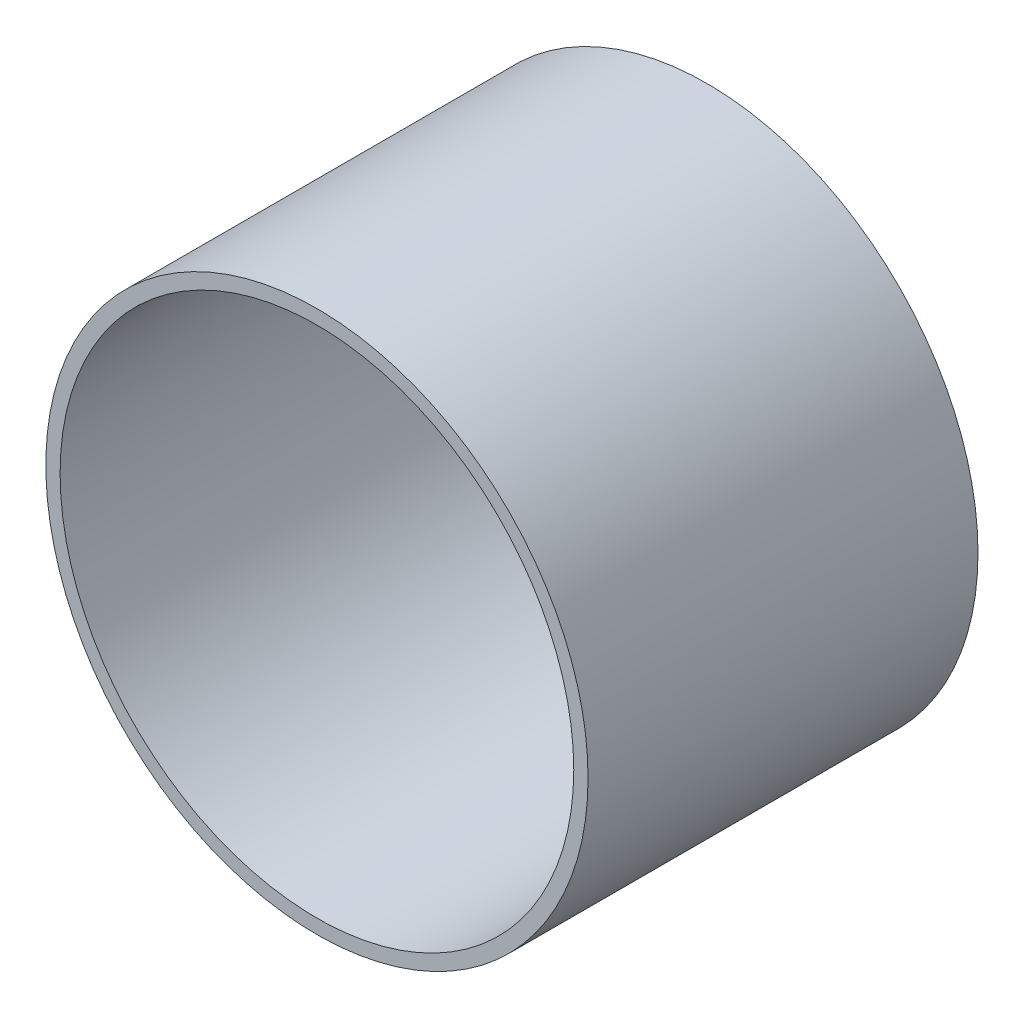
from build123d import *

# Parameters (mm, degrees)
SKETCH1_R           = 57.15
SKETCH1_R_2         = 54.1401
BOSS_EXTRUDE1_DEPTH = 41.1


with BuildPart() as part:
    # Sketch1 → Boss-Extrude1 (new, symmetric)
    with BuildSketch(Plane.XY):
        Circle(SKETCH1_R)
        Circle(SKETCH1_R_2, mode=Mode.SUBTRACT)
    extrude(amount=BOSS_EXTRUDE1_DEPTH, both=True)


solid = part.part
